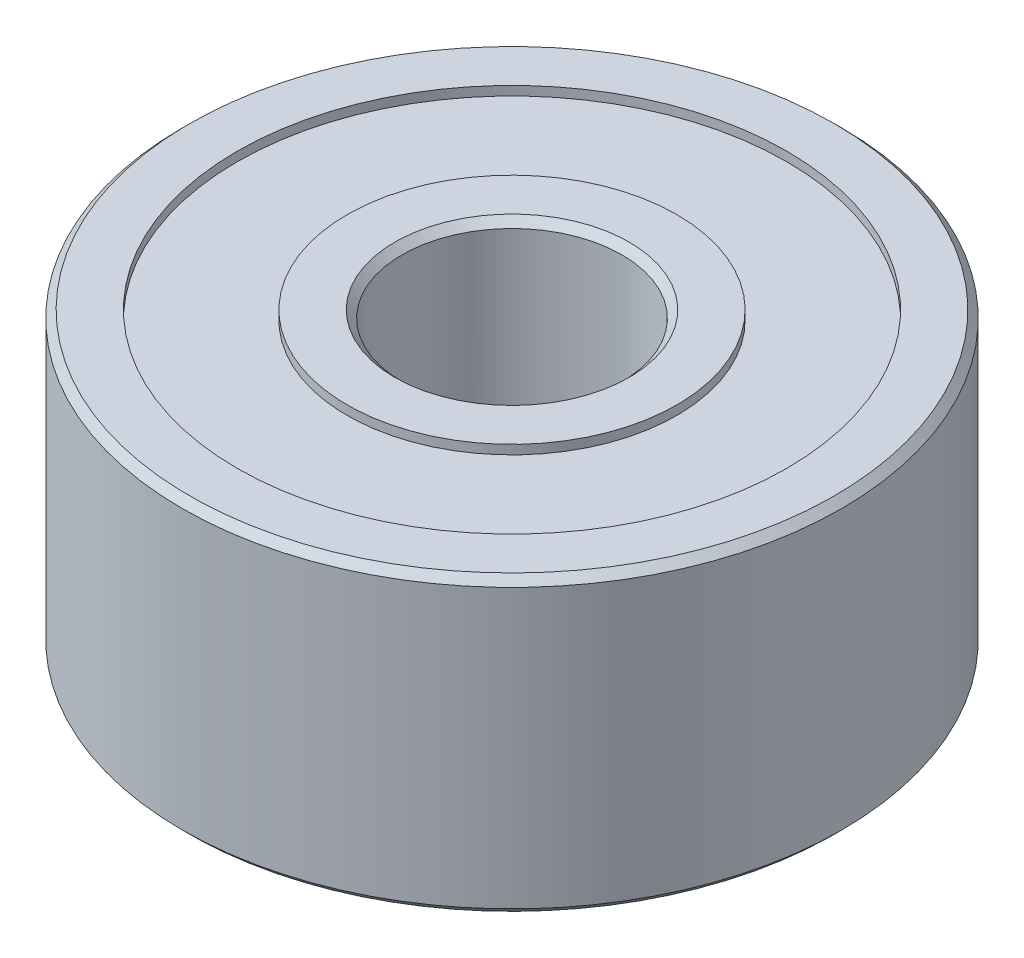
from build123d import *

# Parameters (mm, degrees)
CHAMFER1_SIZE = 0.1


with BuildPart() as part:
    # Sketch2 → Revolve1 (revolve)
    with BuildSketch(Plane.XY, mode=Mode.PRIVATE) as revolve1_sk:
        Polygon((1.5, 2), (1.5, -2), (2.25, -2), (2.25, -1.875), (3.75, -1.875), (3.75, -2), (4.5, -2), (4.5, 2), (3.75, 2), (3.75, 1.875), (2.25, 1.875), (2.25, 2), align=None)
    revolve(revolve1_sk.sketch.rotate(Axis((0, -2, 0), (0, 1, 0)), 90), axis=Axis((0, -2, 0), (0, 1, 0)))

    # Chamfer1
    chamfer1_edges = [part.edges().sort_by_distance(p)[0] for p in [
        (0, 2, 4.5),
        (0, -2, 4.5),
        (0, -2, 1.5),
        (0, 2, 1.5),
    ]]
    chamfer(chamfer1_edges, length=CHAMFER1_SIZE)


solid = part.part
